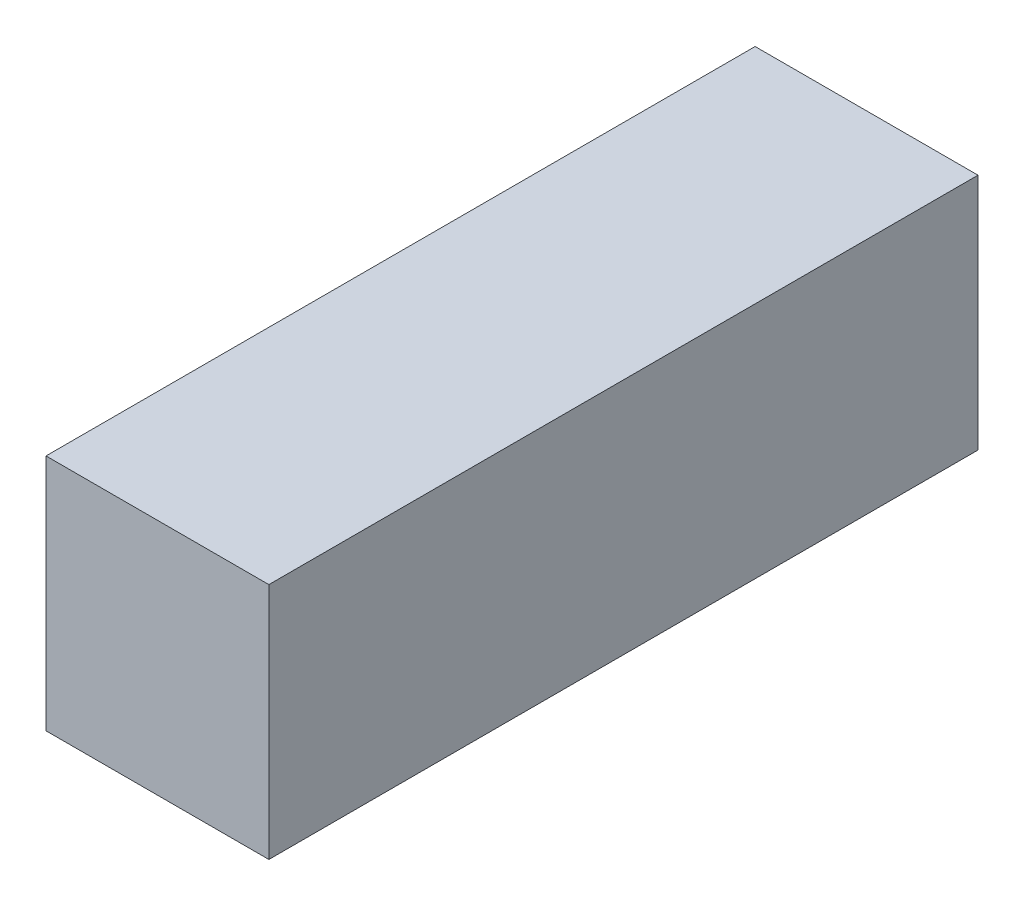
from build123d import *

# Parameters (mm, degrees)
SKETCH1_W           = 44
SKETCH1_H           = 47
BOSS_EXTRUDE1_DEPTH = 140


with BuildPart() as part:
    # Sketch1 → Boss-Extrude1 (new body)
    with BuildSketch(Plane.XY):
        with Locations((22, 23.5)):
            Rectangle(SKETCH1_W, SKETCH1_H)
    extrude(amount=BOSS_EXTRUDE1_DEPTH)


solid = part.part
